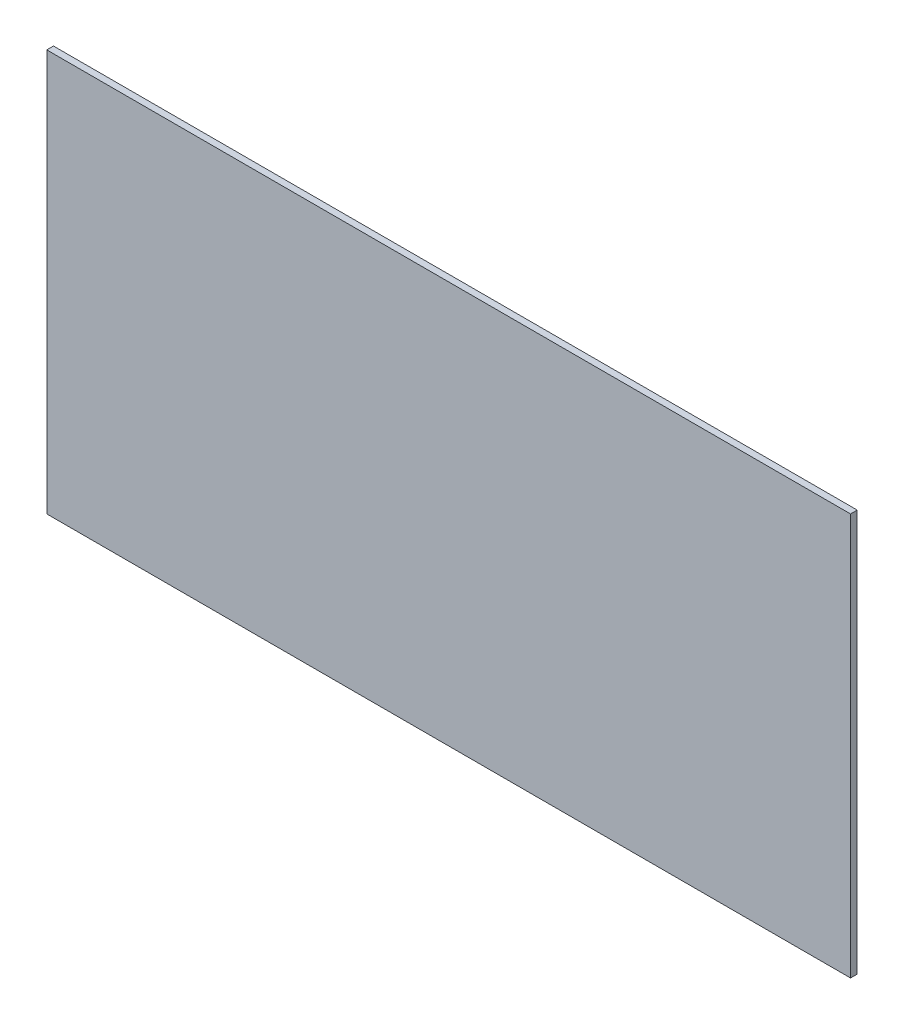
from build123d import *

# Parameters (mm, degrees)
SKETCH1_W           = 304.8
SKETCH1_H           = 152.4
BOSS_EXTRUDE1_DEPTH = 2.54


with BuildPart() as part:
    # Sketch1 → Boss-Extrude1 (new body)
    with BuildSketch(Plane.XY):
        with Locations((152.4, 76.2)):
            Rectangle(SKETCH1_W, SKETCH1_H)
    extrude(amount=BOSS_EXTRUDE1_DEPTH)


solid = part.part
